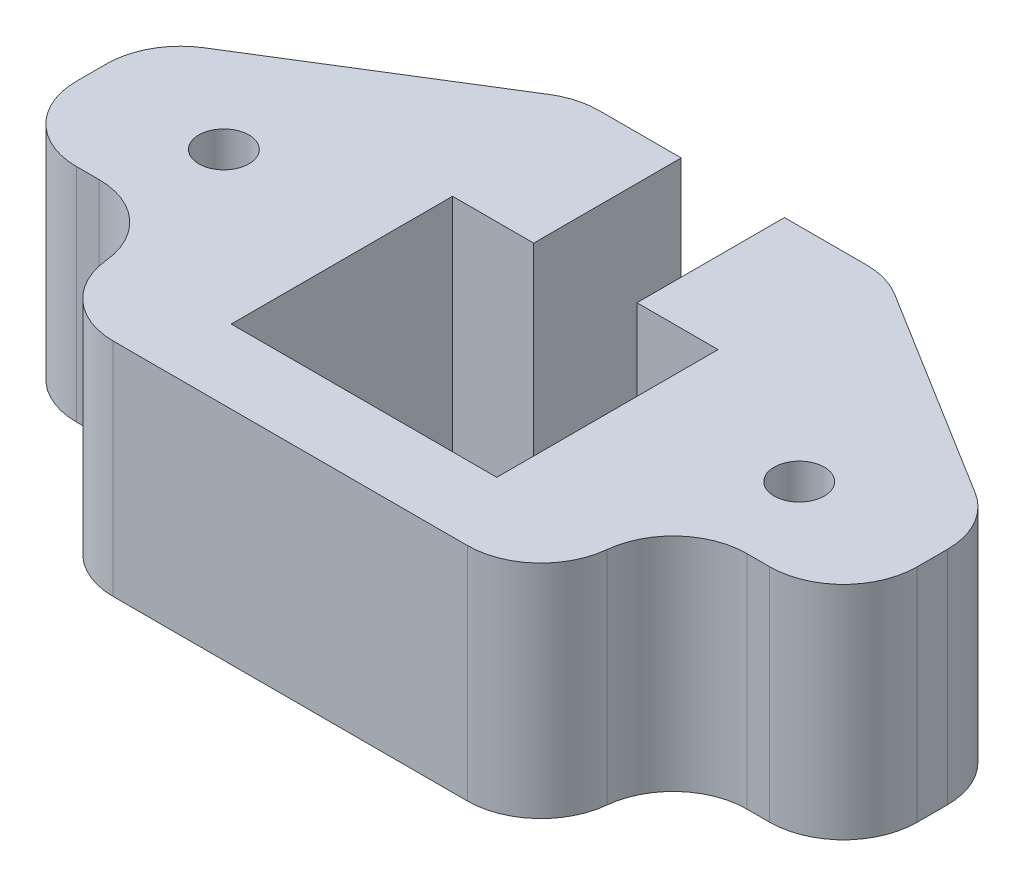
from build123d import *

# Parameters (mm, degrees)
SKETCH_1_R          = 1.7
EXTRUDE_1_DEPTH     = 15
CUT_EXTRUDE_1_DEPTH = 19
FILLET_2_R          = 5
FILLET_3_R          = 5


with BuildPart() as part:
    # 草图1 → 凸台-拉伸1 (new body)
    with BuildSketch(Plane(origin=(0, 0, 0), x_dir=(1, 0, 0), z_dir=(0, 1, 0))):
        Polygon((0, 0), (0, -21), (11.5, -21), (11.5, -30), (45.5, -30), (45.5, -21), (57, -21), (57, 0), (32, 0), (32, -10), (37.5, -10), (37.5, -25), (19.5, -25), (19.5, -10), (25, -10), (25, 0), align=None)
        with Locations(Location((9, -15, 0), (0, 0, 270))):
            Circle(SKETCH_1_R, mode=Mode.SUBTRACT)
        with Locations(Location((48, -15, 0), (0, 0, 270))):
            Circle(SKETCH_1_R, mode=Mode.SUBTRACT)
    extrude(amount=EXTRUDE_1_DEPTH)

    # 草图2 → 切除-拉伸1 (cut)
    with BuildSketch(Plane(origin=(0, 15, 0), x_dir=(1, 0, 0), z_dir=(0, 1, 0))):
        Polygon((18, 0), (0, -11.169748071), (0, 0), align=None)
        Polygon((57, 0), (39, 0), (57, -11.169748071), align=None)
    extrude(amount=-CUT_EXTRUDE_1_DEPTH, mode=Mode.SUBTRACT)

    # 圆角2
    fillet_2_edges = [part.edges().sort_by_distance(p)[0] for p in [
        (57, 7.5, 21),
        (45.5, 7.5, 30),
        (11.5, 7.5, 30),
        (0, 7.5, 21),
        (39, 7.5, 0),
        (0, 7.5, 11.169748071),
        (18, 7.5, 0),
        (57, 7.5, 11.169748071),
    ]]
    fillet(fillet_2_edges, radius=FILLET_2_R)

    # 圆角3
    fillet_3_edges = [part.edges().sort_by_distance(p)[0] for p in [
        (45.5, 7.5, 21),
        (11.5, 7.5, 21),
    ]]
    fillet(fillet_3_edges, radius=FILLET_3_R)


solid = part.part
